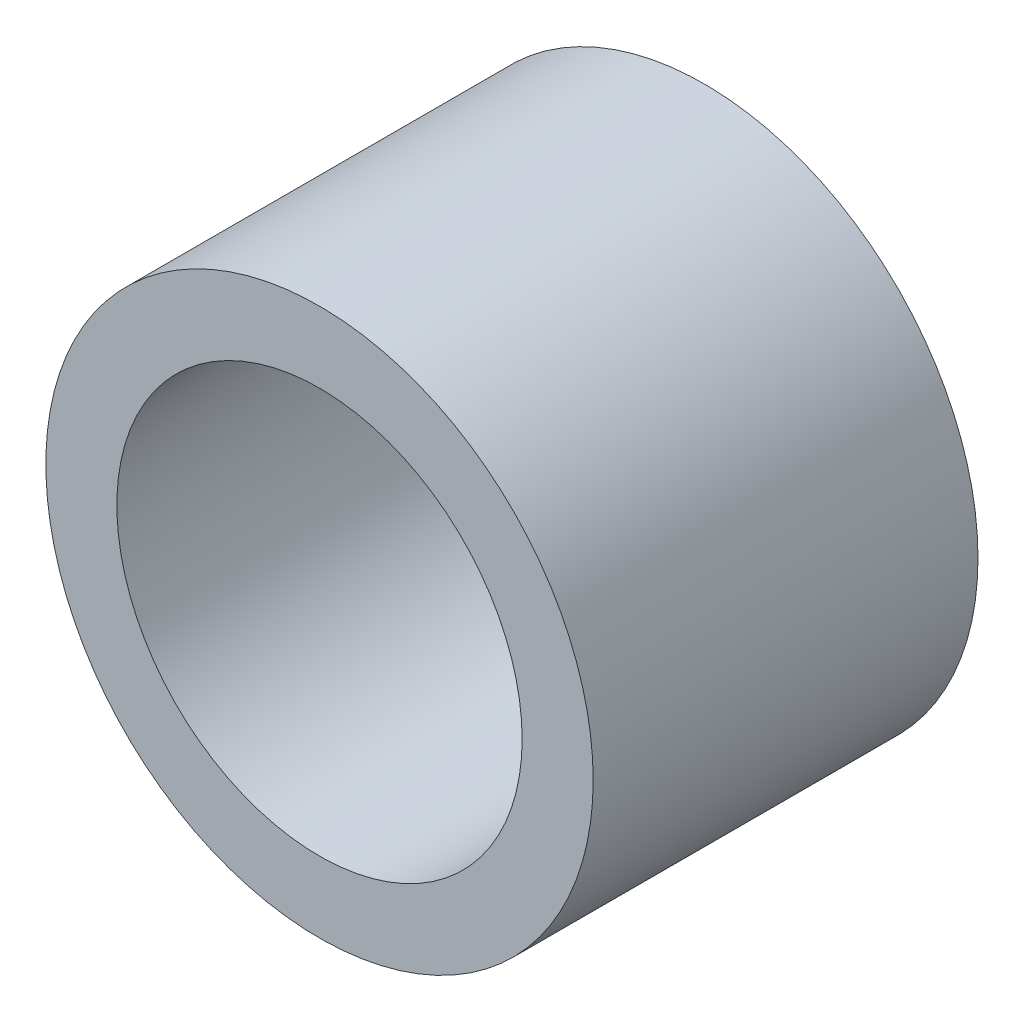
from build123d import *

# Parameters (mm, degrees)
SKETCH1_R           = 10.668
SKETCH1_R_2         = 7.8994
EXTRUDE_THIN1_DEPTH = 7.5


with BuildPart() as part:
    # Sketch1 → Extrude-Thin1 (new, symmetric)
    with BuildSketch(Plane.XY):
        Circle(SKETCH1_R)
        Circle(SKETCH1_R_2, mode=Mode.SUBTRACT)
    extrude(amount=EXTRUDE_THIN1_DEPTH, both=True)


solid = part.part
